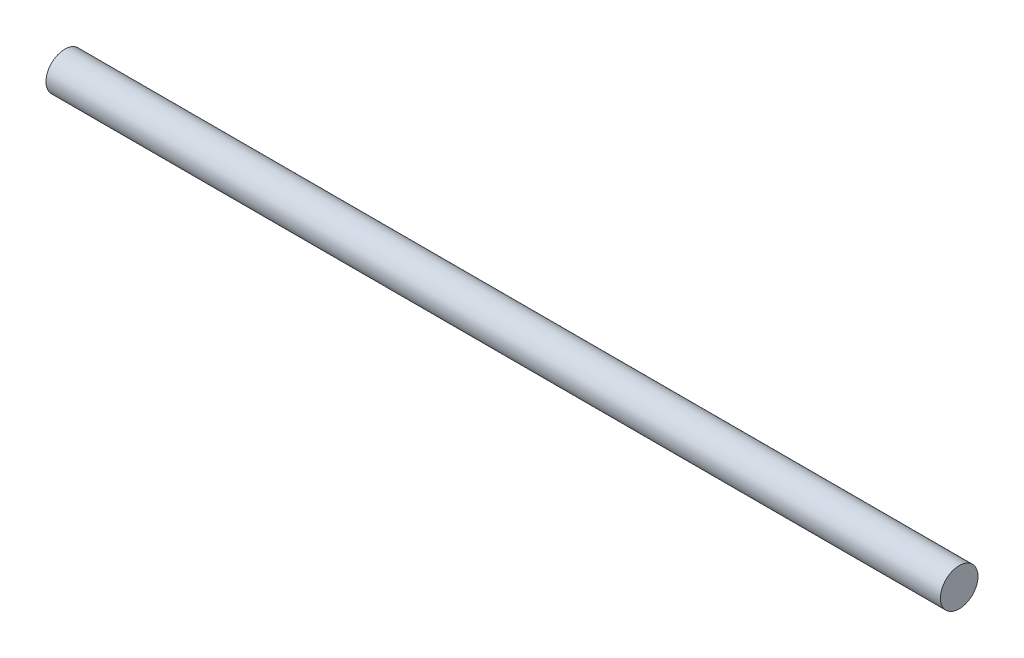
from build123d import *

# Parameters (mm, degrees)
SKETCH1_R           = 1.25
BOSS_EXTRUDE1_DEPTH = 29.75


with BuildPart() as part:
    # Sketch1 → Boss-Extrude1 (new, symmetric)
    with BuildSketch(Plane(origin=(0, 0, 0), x_dir=(0, 0, -1), z_dir=(1, 0, 0))):
        Circle(SKETCH1_R)
    extrude(amount=BOSS_EXTRUDE1_DEPTH, both=True)


solid = part.part
